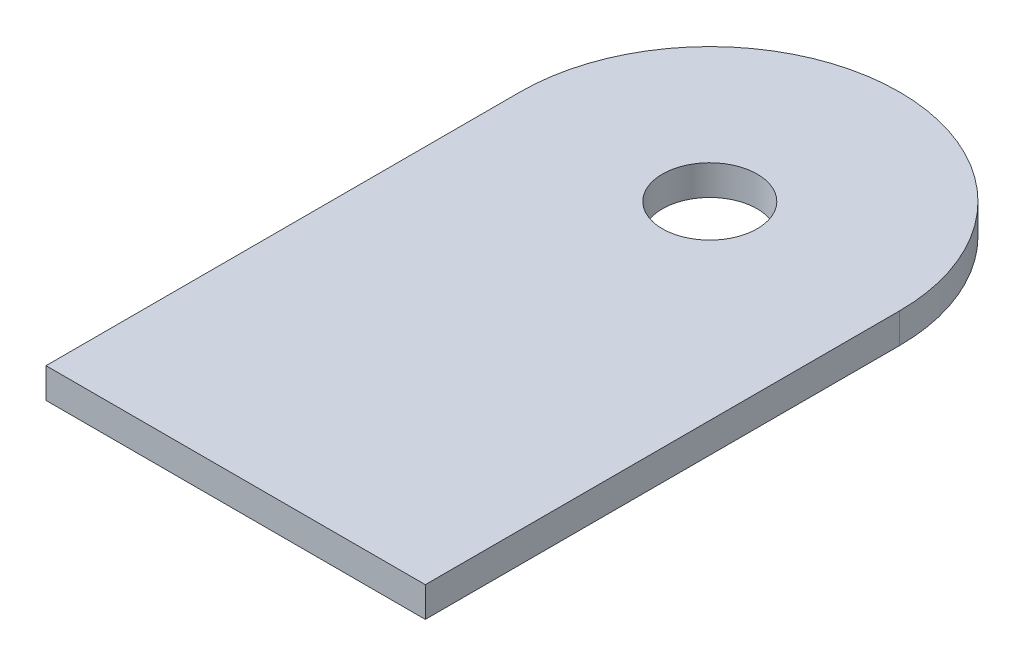
from build123d import *

# Parameters (mm, degrees)
SKETCH1_R           = 2.5
BOSS_EXTRUDE1_DEPTH = 1.5875


with BuildPart() as part:
    # Sketch1 → Boss-Extrude1 (new body)
    with BuildSketch(Plane(origin=(0, 0, 0), x_dir=(1, 0, 0), z_dir=(0, 1, 0))):
        with BuildLine():
            Line((10, 0), (10, -25))
            Line((10, -25), (-10, -25))
            Line((-10, -25), (-10, 0))
            ThreePointArc((-10, 0), (0, 10), (10, 0))
        make_face()
        with Locations(Location((0, 0, 0), (0, 0, 270))):
            Circle(SKETCH1_R, mode=Mode.SUBTRACT)
    extrude(amount=BOSS_EXTRUDE1_DEPTH)


solid = part.part
